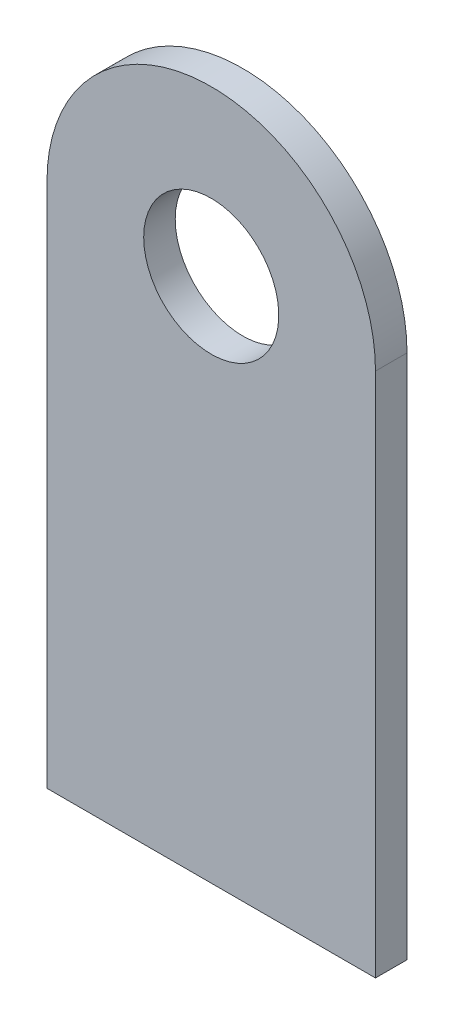
from build123d import *

# Parameters (mm, degrees)
SKETCH1_R           = 3.2639
BOSS_EXTRUDE1_DEPTH = 1.524


with BuildPart() as part:
    # Sketch1 → Boss-Extrude1 (new body)
    with BuildSketch(Plane.XY):
        with BuildLine():
            Line((0, 0), (0, 25.4))
            ThreePointArc((0, 25.4), (7.9375, 33.3375), (15.875, 25.4))
            Line((15.875, 25.4), (15.875, 0))
            Line((15.875, 0), (0, 0))
        make_face()
        with Locations(Location((7.9375, 25.4, 0), (0, 0, 180))):
            Circle(SKETCH1_R, mode=Mode.SUBTRACT)
    extrude(amount=BOSS_EXTRUDE1_DEPTH)


solid = part.part
